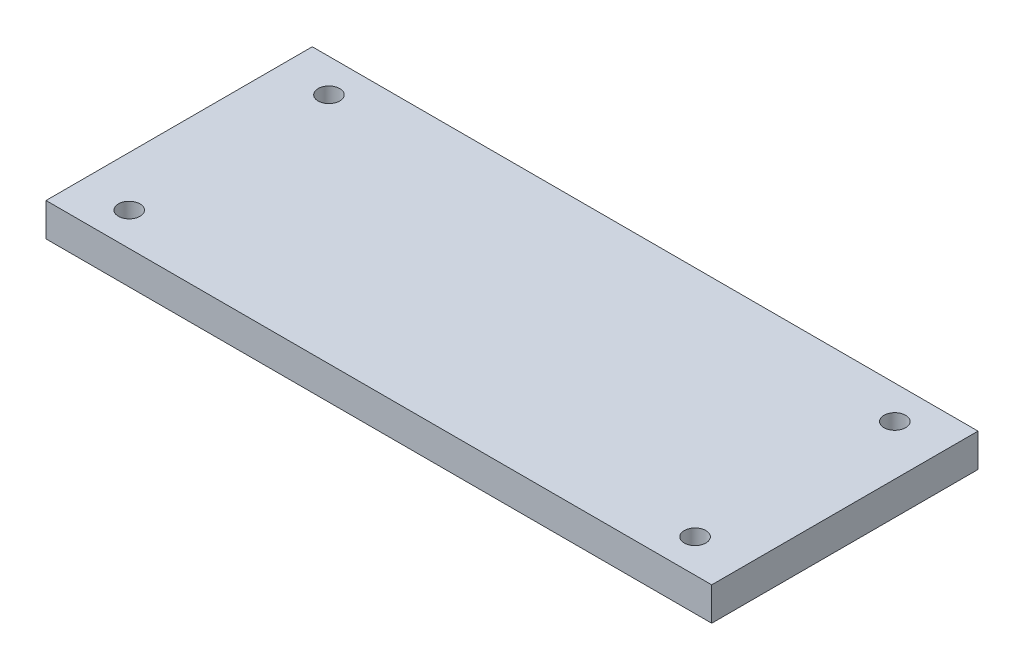
from build123d import *

# Parameters (mm, degrees)
SKETCH1_W           = 200
SKETCH1_H           = 80
BOSS_EXTRUDE1_DEPTH = 10
SKETCH2_R           = 3.25
CUT_EXTRUDE1_DEPTH  = 109.166538264


with BuildPart() as part:
    # Sketch1 → Boss-Extrude1 (new body)
    with BuildSketch(Plane(origin=(0, 0, 0), x_dir=(1, 0, 0), z_dir=(0, 1, 0))):
        Rectangle(SKETCH1_W, SKETCH1_H)
    extrude(amount=BOSS_EXTRUDE1_DEPTH)

    # Sketch2 → Cut-Extrude1 (cut, through all)
    with BuildSketch(Plane(origin=(0, 10, 0), x_dir=(1, 0, 0), z_dir=(0, 1, 0))):
        with Locations(Location((-85, 30, 0), (0, 0, 270))):
            Circle(SKETCH2_R)
        with Locations(Location((85, 30, 0), (0, 0, 90))):
            Circle(SKETCH2_R)
        with Locations(Location((85, -30, 0), (0, 0, 270))):
            Circle(SKETCH2_R)
        with Locations(Location((-85, -30, 0), (0, 0, 90))):
            Circle(SKETCH2_R)
    extrude(amount=-CUT_EXTRUDE1_DEPTH, mode=Mode.SUBTRACT)


solid = part.part
